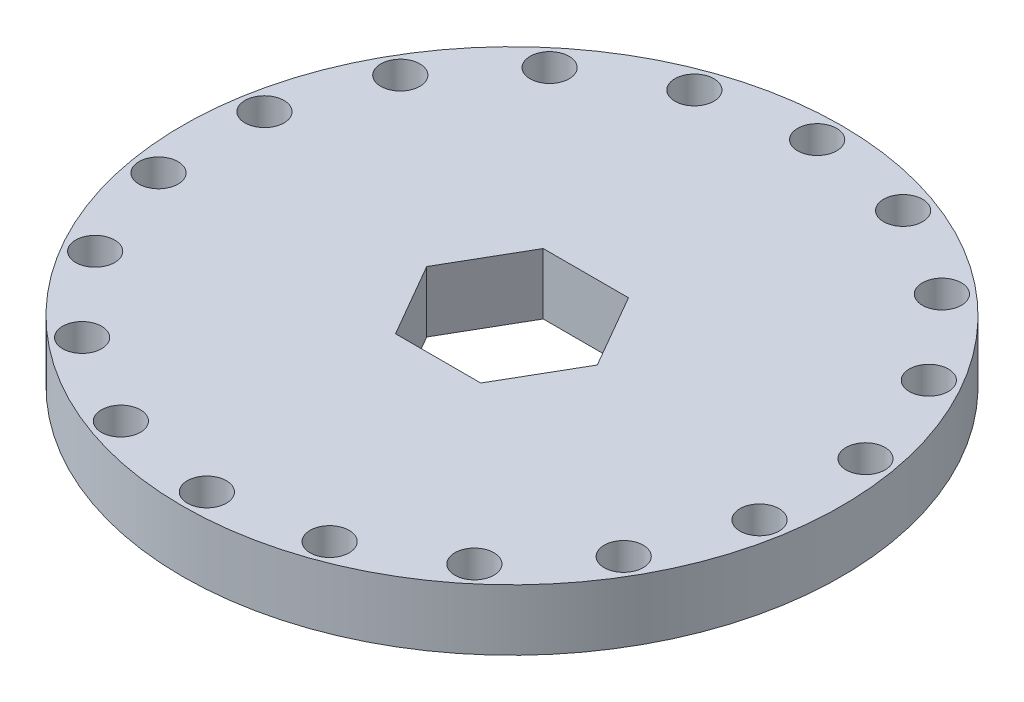
from build123d import *

# Parameters (mm, degrees)
SKETCH_1_R          = 27
SKETCH_1_R_2        = 2
EXTRUDE_1_DEPTH     = 5
CUT_EXTRUDE_1_DEPTH = 5
SKETCH_3_R          = 1.6
CUT_EXTRUDE_2_DEPTH = 10


with BuildPart() as part:
    # 草图1 → 凸台-拉伸1 (new body)
    with BuildSketch(Plane(origin=(0, 0, 0), x_dir=(1, 0, 0), z_dir=(0, 1, 0))):
        with Locations(Location((0, 0, 0), (0, 0, 270))):
            Circle(SKETCH_1_R)
        with Locations(Location((0, 0, 0), (0, 0, 270))):
            Circle(SKETCH_1_R_2, mode=Mode.SUBTRACT)
    extrude(amount=EXTRUDE_1_DEPTH)

    # 草图2 → 切除-拉伸1 (cut)
    with BuildSketch(Plane(origin=(0, 5, 0), x_dir=(1, 0, 0), z_dir=(0, 1, 0))):
        Polygon((-3.492969129, -6.05), (3.492969129, -6.05), (6.985938257, 0), (3.492969129, 6.05), (-3.492969129, 6.05), (-6.985938257, 0), align=None)
    extrude(amount=-CUT_EXTRUDE_1_DEPTH, mode=Mode.SUBTRACT)

    # 草图3 → 切除-拉伸2 (cut)
    with BuildSketch(Plane(origin=(0, 5, 0), x_dir=(1, 0, 0), z_dir=(0, 1, 0))):
        with Locations(Location((0, 25, 0), (0, 0, 270))):
            Circle(SKETCH_3_R)
        with Locations(Location((8.550503583, 23.49231552, 0), (0, 0, 270))):
            Circle(SKETCH_3_R)
        with Locations(Location((16.069690242, 19.151111078, 0), (0, 0, 270))):
            Circle(SKETCH_3_R)
        with Locations(Location((21.650635095, 12.5, 0), (0, 0, 270))):
            Circle(SKETCH_3_R)
        with Locations(Location((24.620193825, 4.341204442, 0), (0, 0, 270))):
            Circle(SKETCH_3_R)
        with Locations(Location((24.620193825, -4.341204442, 0), (0, 0, 270))):
            Circle(SKETCH_3_R)
        with Locations(Location((21.650635095, -12.5, 0), (0, 0, 270))):
            Circle(SKETCH_3_R)
        with Locations(Location((16.069690242, -19.151111078, 0), (0, 0, 270))):
            Circle(SKETCH_3_R)
        with Locations(Location((8.550503583, -23.49231552, 0), (0, 0, 270))):
            Circle(SKETCH_3_R)
        with Locations(Location((0, -25, 0), (0, 0, 270))):
            Circle(SKETCH_3_R)
        with Locations(Location((-8.550503583, -23.49231552, 0), (0, 0, 270))):
            Circle(SKETCH_3_R)
        with Locations(Location((-16.069690242, -19.151111078, 0), (0, 0, 270))):
            Circle(SKETCH_3_R)
        with Locations(Location((-21.650635095, -12.5, 0), (0, 0, 270))):
            Circle(SKETCH_3_R)
        with Locations(Location((-24.620193825, -4.341204442, 0), (0, 0, 270))):
            Circle(SKETCH_3_R)
        with Locations(Location((-24.620193825, 4.341204442, 0), (0, 0, 270))):
            Circle(SKETCH_3_R)
        with Locations(Location((-21.650635095, 12.5, 0), (0, 0, 270))):
            Circle(SKETCH_3_R)
        with Locations(Location((-16.069690242, 19.151111078, 0), (0, 0, 270))):
            Circle(SKETCH_3_R)
        with Locations(Location((-8.550503583, 23.49231552, 0), (0, 0, 270))):
            Circle(SKETCH_3_R)
    extrude(amount=-CUT_EXTRUDE_2_DEPTH, mode=Mode.SUBTRACT)


solid = part.part
